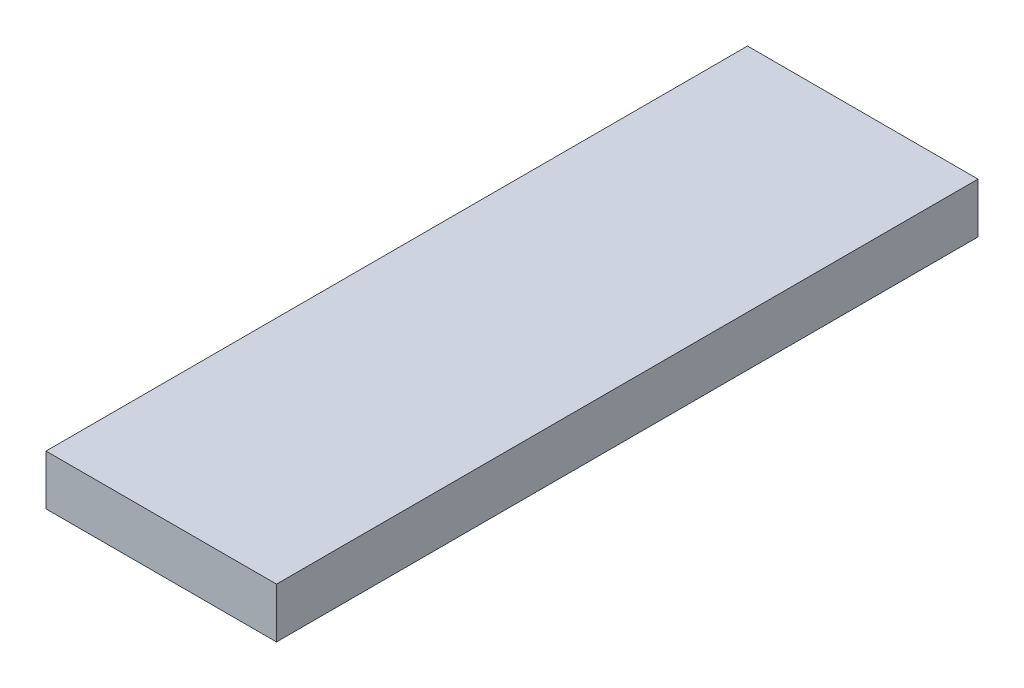
from build123d import *

# Parameters (mm, degrees)
SKETCH_1_W      = 23
SKETCH_1_H      = 70
EXTRUDE_1_DEPTH = 5


with BuildPart() as part:
    # 草图1 → 凸台-拉伸1 (new body)
    with BuildSketch(Plane(origin=(0, 0, 0), x_dir=(1, 0, 0), z_dir=(0, 1, 0))):
        Rectangle(SKETCH_1_W, SKETCH_1_H)
    extrude(amount=EXTRUDE_1_DEPTH)


solid = part.part
